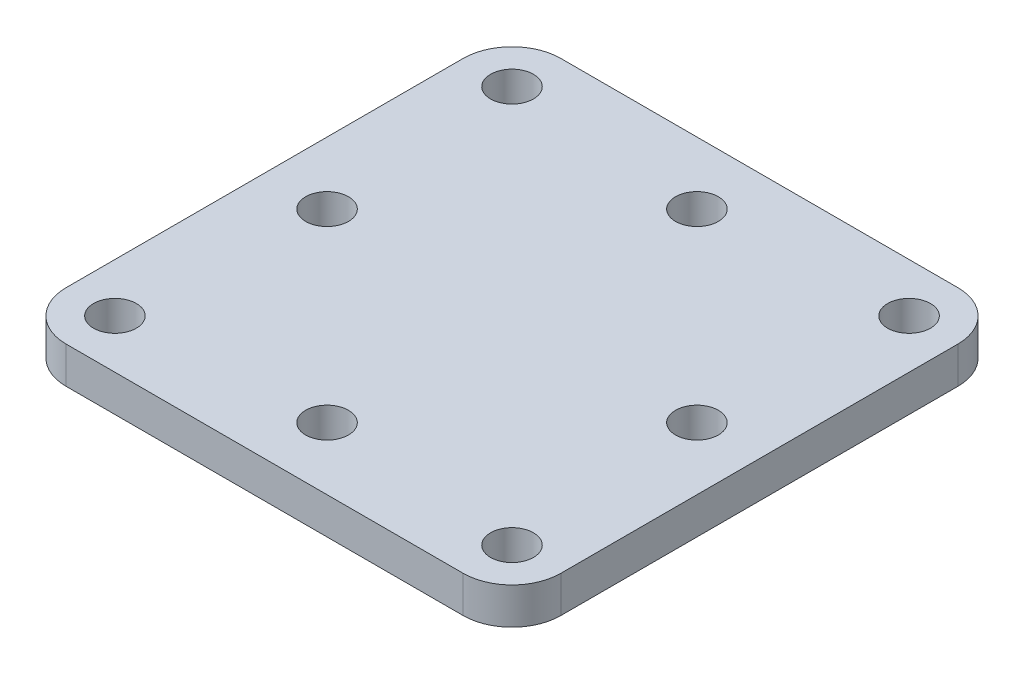
from build123d import *

# Parameters (mm, degrees)
SKETCH1_R               = 11.9
SKETCH1_R_2             = 9.9
BOSS_EXTRUDE3_DEPTH     = 15
SKETCH4_R               = 9.9
BOSS_EXTRUDE4_DEPTH     = 5.1
BOSS_EXTRUDE8_START     = -3
SKETCH12_R              = 19
SKETCH12_R_2            = 11.9
BOSS_EXTRUDE8_DEPTH     = 3
SKETCH14_R              = 1.755
CUT_EXTRUDE4_DEPTH      = 3
CUT_EXTRUDE5_DEPTH      = 25
CUT_EXTRUDE5_DEPTH_BACK = 20
SKETCH15_W              = 38
SKETCH15_H              = 16.079993569
BOSS_EXTRUDE9_START     = -3
SKETCH16_R              = 9.9
BOSS_EXTRUDE9_DEPTH     = 3
BOSS_EXTRUDE10_START    = -3
SKETCH17_W              = 40
SKETCH17_H              = 40
SKETCH17_R              = 19
BOSS_EXTRUDE10_DEPTH    = 3
SKETCH20_W              = 60
SKETCH20_H              = 60
SKETCH20_W_2            = 40
SKETCH20_H_2            = 40
BOSS_EXTRUDE11_DEPTH    = 3
SKETCH21_R              = 1.755
CUT_EXTRUDE7_DEPTH      = 3
SKETCH23_W              = 60
SKETCH23_H              = 60
CUT_EXTRUDE9_DEPTH      = 3


with BuildPart() as part:
    # Sketch1 → Boss-Extrude3 (new body)
    with BuildSketch(Plane(origin=(0, 0, 0), x_dir=(1, 0, 0), z_dir=(0, 1, 0))):
        with Locations(Location((0, 0, 0), (0, 0, 270))):
            Circle(SKETCH1_R)
        with Locations(Location((0, 0, 0), (0, 0, 270))):
            Circle(SKETCH1_R_2, mode=Mode.SUBTRACT)
    extrude(amount=BOSS_EXTRUDE3_DEPTH)

    # Sketch4 → Boss-Extrude4 (add)
    with BuildSketch(Plane.XZ):
        with Locations(Location((0, 0, 0), (0, 0, 270))):
            Circle(SKETCH4_R)
    extrude(amount=-BOSS_EXTRUDE4_DEPTH)

    # Sketch7 → Cut-Revolve2 (revolve, cut)
    with BuildSketch(Plane(origin=(0, 0, 0), x_dir=(0, 0, -1), z_dir=(1, 0, 0))):
        with BuildLine():
            Line((0, 15), (0, -4.8))
            ThreePointArc((0, -4.8), (9.9, 5.1), (0, 15))
        make_face()
    revolve(axis=Axis((0, 15, 0), (0, -1, 0)), mode=Mode.SUBTRACT)

    # Sketch12 → Boss-Extrude8 (add)
    with BuildSketch(Plane(origin=(0, 15, 0), x_dir=(1, 0, 0), z_dir=(0, 1, 0)).offset(BOSS_EXTRUDE8_START)):
        with Locations(Location((0, 0, 0), (0, 0, 270))):
            Circle(SKETCH12_R)
        with Locations(Location((0, 0, 0), (0, 0, 270))):
            Circle(SKETCH12_R_2, mode=Mode.SUBTRACT)
    extrude(amount=BOSS_EXTRUDE8_DEPTH)

    # Sketch14 → Cut-Extrude4 (cut)
    with BuildSketch(Plane(origin=(0, 15, 0), x_dir=(1, 0, 0), z_dir=(0, 1, 0))):
        with Locations(Location((0, 15.15, 0), (0, 0, 270))):
            Circle(SKETCH14_R)
        with Locations(Location((-15.15, 0, 0), (0, 0, 270))):
            Circle(SKETCH14_R)
        with Locations(Location((0, -15.15, 0), (0, 0, 270))):
            Circle(SKETCH14_R)
        with Locations(Location((15.15, 0, 0), (0, 0, 270))):
            Circle(SKETCH14_R)
    extrude(amount=-CUT_EXTRUDE4_DEPTH, mode=Mode.SUBTRACT)

    # Sketch15 → Cut-Extrude5 (cut, two sides: drawn at the far end of the back side and taken through both)
    with BuildSketch(Plane(origin=(0, 0, 0), x_dir=(0, 0, -1), z_dir=(1, 0, 0)).offset(-CUT_EXTRUDE5_DEPTH_BACK)):
        with Locations((0, 3.960003216)):
            Rectangle(SKETCH15_W, SKETCH15_H)
    extrude(amount=CUT_EXTRUDE5_DEPTH + CUT_EXTRUDE5_DEPTH_BACK, mode=Mode.SUBTRACT)

    # Sketch16 → Boss-Extrude9 (add)
    with BuildSketch(Plane(origin=(0, 15, 0), x_dir=(1, 0, 0), z_dir=(0, 1, 0)).offset(BOSS_EXTRUDE9_START)):
        Circle(SKETCH16_R)
    extrude(amount=BOSS_EXTRUDE9_DEPTH)

    # Sketch17 → Boss-Extrude10 (add)
    with BuildSketch(Plane(origin=(0, 15, 0), x_dir=(1, 0, 0), z_dir=(0, 1, 0)).offset(BOSS_EXTRUDE10_START)):
        Rectangle(SKETCH17_W, SKETCH17_H)
        Circle(SKETCH17_R, mode=Mode.SUBTRACT)
    extrude(amount=BOSS_EXTRUDE10_DEPTH)

    # Sketch20 → Boss-Extrude11 (add)
    with BuildSketch(Plane(origin=(0, 15, 0), x_dir=(1, 0, 0), z_dir=(0, 1, 0))):
        Rectangle(SKETCH20_W, SKETCH20_H)
        Rectangle(SKETCH20_W_2, SKETCH20_H_2, mode=Mode.SUBTRACT)
    extrude(amount=-BOSS_EXTRUDE11_DEPTH)

    # Sketch21 → Cut-Extrude7 (cut)
    with BuildSketch(Plane(origin=(0, 15, 0), x_dir=(1, 0, 0), z_dir=(0, 1, 0))):
        with Locations(Location((-16.263455967, 16.263455967, 0), (0, 0, 270))):
            Circle(SKETCH21_R)
        with Locations(Location((-16.263455967, -16.263455967, 0), (0, 0, 270))):
            Circle(SKETCH21_R)
        with Locations(Location((16.263455967, 16.263455967, 0), (0, 0, 270))):
            Circle(SKETCH21_R)
        with Locations(Location((16.263455967, -16.263455967, 0), (0, 0, 270))):
            Circle(SKETCH21_R)
    extrude(amount=-CUT_EXTRUDE7_DEPTH, mode=Mode.SUBTRACT)

    # Sketch23 → Cut-Extrude9 (cut)
    with BuildSketch(Plane(origin=(0, 15, 0), x_dir=(1, 0, 0), z_dir=(0, 1, 0))):
        Rectangle(SKETCH23_W, SKETCH23_H)
        with BuildLine():
            Line((-20.263455967, -16.263455967), (-20.263455967, 16.263455967))
            ThreePointArc((-20.263455967, 16.263455967), (-19.091883092, 19.091883092), (-16.263455967, 20.263455967))
            Line((-16.263455967, 20.263455967), (16.263455967, 20.263455967))
            ThreePointArc((16.263455967, 20.263455967), (19.091883092, 19.091883092), (20.263455967, 16.263455967))
            Line((20.263455967, 16.263455967), (20.263455967, -16.263455967))
            ThreePointArc((20.263455967, -16.263455967), (19.091883092, -19.091883092), (16.263455967, -20.263455967))
            Line((16.263455967, -20.263455967), (-16.263455967, -20.263455967))
            ThreePointArc((-16.263455967, -20.263455967), (-19.091883092, -19.091883092), (-20.263455967, -16.263455967))
        make_face(mode=Mode.SUBTRACT)
    extrude(amount=-CUT_EXTRUDE9_DEPTH, mode=Mode.SUBTRACT)


solid = part.part
